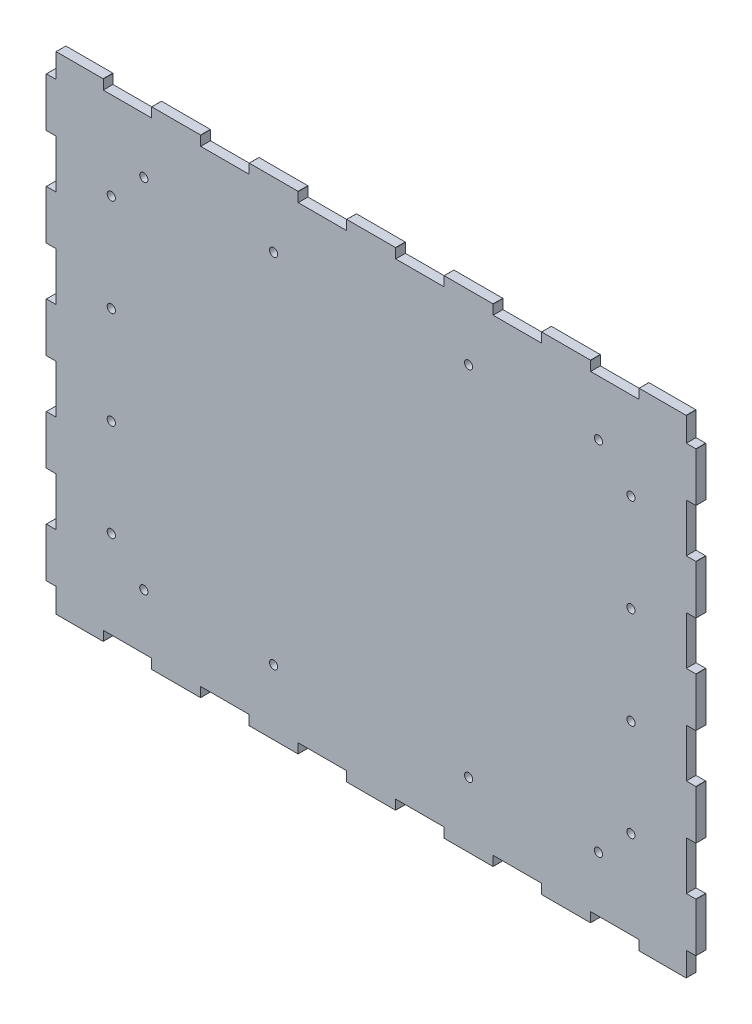
from build123d import *

# Parameters (mm, degrees)
BOSS_EXTRUDE1_DEPTH = 5
SKETCH1_R           = 2.1
CUT_EXTRUDE1_DEPTH  = 209.354002841


with BuildPart() as part:
    # Model → Boss-Extrude1 (new body)
    with BuildSketch(Plane.XY):
        Polygon((-137.44, -124.95), (-137.43, -124.94), (-137.42, -124.92), (-137.41, -124.91), (-137.4, -124.89), (-137.4, -119.97), (-112.6, -119.97), (-112.6, -124.89), (-112.58, -124.93), (-112.57, -124.94), (-112.55, -124.95), (-112.54, -124.96), (-112.52, -124.97), (-87.48, -124.97), (-87.44, -124.95), (-87.43, -124.94), (-87.42, -124.92), (-87.41, -124.91), (-87.4, -124.89), (-87.4, -119.97), (-62.6, -119.97), (-62.6, -124.89), (-62.58, -124.93), (-62.57, -124.94), (-62.55, -124.95), (-62.54, -124.96), (-62.52, -124.97), (-37.48, -124.97), (-37.44, -124.95), (-37.43, -124.94), (-37.42, -124.92), (-37.41, -124.91), (-37.4, -124.89), (-37.4, -119.97), (-12.6, -119.97), (-12.6, -124.89), (-12.58, -124.93), (-12.57, -124.94), (-12.55, -124.95), (-12.54, -124.96), (-12.52, -124.97), (12.52, -124.97), (12.56, -124.95), (12.57, -124.94), (12.58, -124.92), (12.59, -124.91), (12.6, -124.89), (12.6, -119.97), (37.4, -119.97), (37.4, -124.89), (37.42, -124.93), (37.43, -124.94), (37.45, -124.95), (37.46, -124.96), (37.48, -124.97), (62.52, -124.97), (62.56, -124.95), (62.57, -124.94), (62.58, -124.92), (62.59, -124.91), (62.6, -124.89), (62.6, -119.97), (87.4, -119.97), (87.4, -124.89), (87.42, -124.93), (87.43, -124.94), (87.45, -124.95), (87.46, -124.96), (87.48, -124.97), (112.52, -124.97), (112.56, -124.95), (112.57, -124.94), (112.58, -124.92), (112.59, -124.91), (112.6, -124.89), (112.6, -119.97), (137.4, -119.97), (137.4, -124.89), (137.42, -124.93), (137.43, -124.94), (137.45, -124.95), (137.46, -124.96), (137.48, -124.97), (161.56, -124.97), (161.6, -124.95), (161.61, -124.94), (161.62, -124.92), (161.63, -124.91), (161.64, -124.89), (161.64, -112.6), (166.56, -112.6), (166.6, -112.58), (166.61, -112.57), (166.62, -112.55), (166.63, -112.54), (166.64, -112.52), (166.64, -87.48), (166.62, -87.44), (166.61, -87.43), (166.59, -87.42), (166.58, -87.41), (166.56, -87.4), (161.64, -87.4), (161.64, -62.6), (166.56, -62.6), (166.6, -62.58), (166.61, -62.57), (166.62, -62.55), (166.63, -62.54), (166.64, -62.52), (166.64, -37.48), (166.62, -37.44), (166.61, -37.43), (166.59, -37.42), (166.58, -37.41), (166.56, -37.4), (161.64, -37.4), (161.64, -12.6), (166.56, -12.6), (166.6, -12.58), (166.61, -12.57), (166.62, -12.55), (166.63, -12.54), (166.64, -12.52), (166.64, 12.52), (166.62, 12.56), (166.61, 12.57), (166.59, 12.58), (166.58, 12.59), (166.56, 12.6), (161.64, 12.6), (161.64, 37.4), (166.56, 37.4), (166.6, 37.42), (166.61, 37.43), (166.62, 37.45), (166.63, 37.46), (166.64, 37.48), (166.64, 62.52), (166.62, 62.56), (166.61, 62.57), (166.59, 62.58), (166.58, 62.59), (166.56, 62.6), (161.64, 62.6), (161.64, 87.4), (166.56, 87.4), (166.6, 87.42), (166.61, 87.43), (166.62, 87.45), (166.63, 87.46), (166.64, 87.48), (166.64, 112.52), (166.62, 112.56), (166.61, 112.57), (166.59, 112.58), (166.58, 112.59), (166.56, 112.6), (161.64, 112.6), (161.64, 124.89), (161.62, 124.93), (161.61, 124.94), (161.59, 124.95), (161.58, 124.96), (161.56, 124.97), (137.48, 124.97), (137.44, 124.95), (137.43, 124.94), (137.42, 124.92), (137.41, 124.91), (137.4, 124.89), (137.4, 119.97), (112.6, 119.97), (112.6, 124.89), (112.58, 124.93), (112.57, 124.94), (112.55, 124.95), (112.54, 124.96), (112.52, 124.97), (87.48, 124.97), (87.44, 124.95), (87.43, 124.94), (87.42, 124.92), (87.41, 124.91), (87.4, 124.89), (87.4, 119.97), (62.6, 119.97), (62.6, 124.89), (62.58, 124.93), (62.57, 124.94), (62.55, 124.95), (62.54, 124.96), (62.52, 124.97), (37.48, 124.97), (37.44, 124.95), (37.43, 124.94), (37.42, 124.92), (37.41, 124.91), (37.4, 124.89), (37.4, 119.97), (12.6, 119.97), (12.6, 124.89), (12.58, 124.93), (12.57, 124.94), (12.55, 124.95), (12.54, 124.96), (12.52, 124.97), (-12.52, 124.97), (-12.56, 124.95), (-12.57, 124.94), (-12.58, 124.92), (-12.59, 124.91), (-12.6, 124.89), (-12.6, 119.97), (-37.4, 119.97), (-37.4, 124.89), (-37.42, 124.93), (-37.43, 124.94), (-37.45, 124.95), (-37.46, 124.96), (-37.48, 124.97), (-62.52, 124.97), (-62.56, 124.95), (-62.57, 124.94), (-62.58, 124.92), (-62.59, 124.91), (-62.6, 124.89), (-62.6, 119.97), (-87.4, 119.97), (-87.4, 124.89), (-87.42, 124.93), (-87.43, 124.94), (-87.45, 124.95), (-87.46, 124.96), (-87.48, 124.97), (-112.52, 124.97), (-112.56, 124.95), (-112.57, 124.94), (-112.58, 124.92), (-112.59, 124.91), (-112.6, 124.89), (-112.6, 119.97), (-137.4, 119.97), (-137.4, 124.89), (-137.42, 124.93), (-137.43, 124.94), (-137.45, 124.95), (-137.46, 124.96), (-137.48, 124.97), (-161.56, 124.97), (-161.6, 124.95), (-161.61, 124.94), (-161.62, 124.92), (-161.63, 124.91), (-161.64, 124.89), (-161.64, 112.6), (-166.56, 112.6), (-166.6, 112.58), (-166.61, 112.57), (-166.62, 112.55), (-166.63, 112.54), (-166.64, 112.52), (-166.64, 87.48), (-166.62, 87.44), (-166.61, 87.43), (-166.59, 87.42), (-166.58, 87.41), (-166.56, 87.4), (-161.64, 87.4), (-161.64, 62.6), (-166.56, 62.6), (-166.6, 62.58), (-166.61, 62.57), (-166.62, 62.55), (-166.63, 62.54), (-166.64, 62.52), (-166.64, 37.48), (-166.62, 37.44), (-166.61, 37.43), (-166.59, 37.42), (-166.58, 37.41), (-166.56, 37.4), (-161.64, 37.4), (-161.64, 12.6), (-166.56, 12.6), (-166.6, 12.58), (-166.61, 12.57), (-166.62, 12.55), (-166.63, 12.54), (-166.64, 12.52), (-166.64, -12.52), (-166.62, -12.56), (-166.61, -12.57), (-166.59, -12.58), (-166.58, -12.59), (-166.56, -12.6), (-161.64, -12.6), (-161.64, -37.4), (-166.56, -37.4), (-166.6, -37.42), (-166.61, -37.43), (-166.62, -37.45), (-166.63, -37.46), (-166.64, -37.48), (-166.64, -62.52), (-166.62, -62.56), (-166.61, -62.57), (-166.59, -62.58), (-166.58, -62.59), (-166.56, -62.6), (-161.64, -62.6), (-161.64, -87.4), (-166.56, -87.4), (-166.6, -87.42), (-166.61, -87.43), (-166.62, -87.45), (-166.63, -87.46), (-166.64, -87.48), (-166.64, -112.52), (-166.62, -112.56), (-166.61, -112.57), (-166.59, -112.58), (-166.58, -112.59), (-166.56, -112.6), (-161.64, -112.6), (-161.64, -124.89), (-161.62, -124.93), (-161.61, -124.94), (-161.59, -124.95), (-161.58, -124.96), (-161.56, -124.97), (-137.48, -124.97), align=None)
    extrude(amount=BOSS_EXTRUDE1_DEPTH)

    # Sketch1 → Cut-Extrude1 (cut, through all)
    with BuildSketch(Plane.XY.offset(5)):
        with Locations((-116.603333333, 91.603333333)):
            Circle(SKETCH1_R)
        with Locations((-133.27, 74.936666667)):
            Circle(SKETCH1_R)
        with Locations(Location((133.27, 74.936666667, 0), (0, 0, 180))):
            Circle(SKETCH1_R)
        with Locations(Location((116.603333333, 91.603333333, 0), (0, 0, 180))):
            Circle(SKETCH1_R)
        with Locations((133.27, -74.936666667)):
            Circle(SKETCH1_R)
        with Locations((116.603333333, -91.603333333)):
            Circle(SKETCH1_R)
        with Locations(Location((-116.603333333, -91.603333333, 0), (0, 0, 180))):
            Circle(SKETCH1_R)
        with Locations(Location((-133.27, -74.936666667, 0), (0, 0, 180))):
            Circle(SKETCH1_R)
        with Locations((-50, 91.603333333)):
            Circle(SKETCH1_R)
        with Locations((50, 91.603333333)):
            Circle(SKETCH1_R)
        with Locations(Location((50, -91.603333333, 0), (0, 0, 180))):
            Circle(SKETCH1_R)
        with Locations(Location((-50, -91.603333333, 0), (0, 0, 180))):
            Circle(SKETCH1_R)
        with Locations((-133.27, 25)):
            Circle(SKETCH1_R)
        with Locations((-133.27, -25)):
            Circle(SKETCH1_R)
        with Locations(Location((133.27, 25, 0), (0, 0, 180))):
            Circle(SKETCH1_R)
        with Locations(Location((133.27, -25, 0), (0, 0, 180))):
            Circle(SKETCH1_R)
    extrude(amount=-CUT_EXTRUDE1_DEPTH, mode=Mode.SUBTRACT)


solid = part.part
